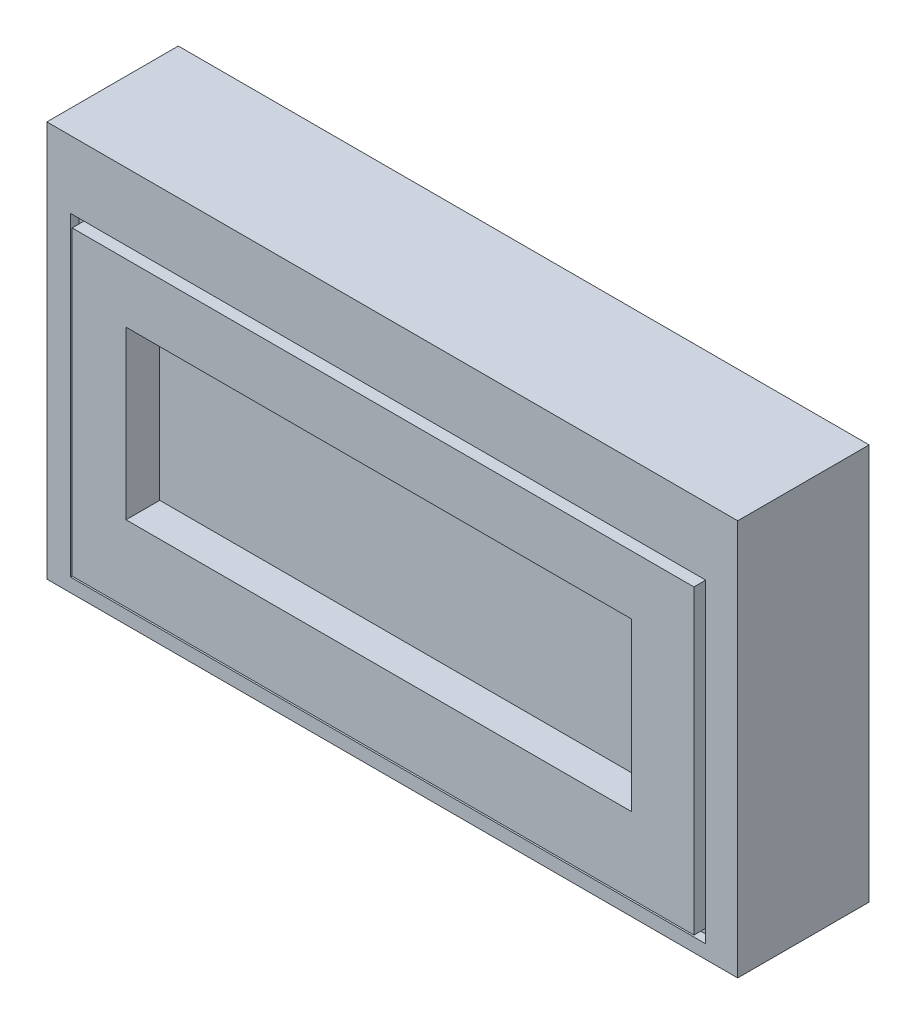
from build123d import *

# Parameters (mm, degrees)
CROQUIS1_W              = 410
CROQUIS1_H              = 235
SALIENTE_EXTRUIR1_DEPTH = 78
CROQUIS2_W              = 377
CROQUIS2_H              = 186.930394922
CORTAR_EXTRUIR1_DEPTH   = 5
CROQUIS3_W              = 369
CROQUIS3_H              = 178.930394922
SALIENTE_EXTRUIR2_DEPTH = 8
CROQUIS5_W              = 300
CROQUIS5_H              = 99
CORTAR_EXTRUIR2_DEPTH   = 20


with BuildPart() as part:
    # Croquis1 → Saliente-Extruir1 (new body)
    with BuildSketch(Plane.XY):
        with Locations((161.576639223, 109.430394922)):
            Rectangle(CROQUIS1_W, CROQUIS1_H)
    extrude(amount=SALIENTE_EXTRUIR1_DEPTH)

    # Croquis2 → Cortar-Extruir1 (cut)
    with BuildSketch(Plane.XY.offset(78)):
        with Locations((159.076639223, 93.465197461)):
            Rectangle(CROQUIS2_W, CROQUIS2_H)
    extrude(amount=-CORTAR_EXTRUIR1_DEPTH, mode=Mode.SUBTRACT)

    # Croquis3 → Saliente-Extruir2 (add)
    with BuildSketch(Plane.XY.offset(73)):
        with Locations((159.076639223, 93.465197461)):
            Rectangle(CROQUIS3_W, CROQUIS3_H)
    extrude(amount=SALIENTE_EXTRUIR2_DEPTH)

    # Croquis5 → Cortar-Extruir2 (cut)
    with BuildSketch(Plane.XY.offset(81)):
        with Locations((156.576639223, 98.430394922)):
            Rectangle(CROQUIS5_W, CROQUIS5_H)
    extrude(amount=-CORTAR_EXTRUIR2_DEPTH, mode=Mode.SUBTRACT)


solid = part.part
